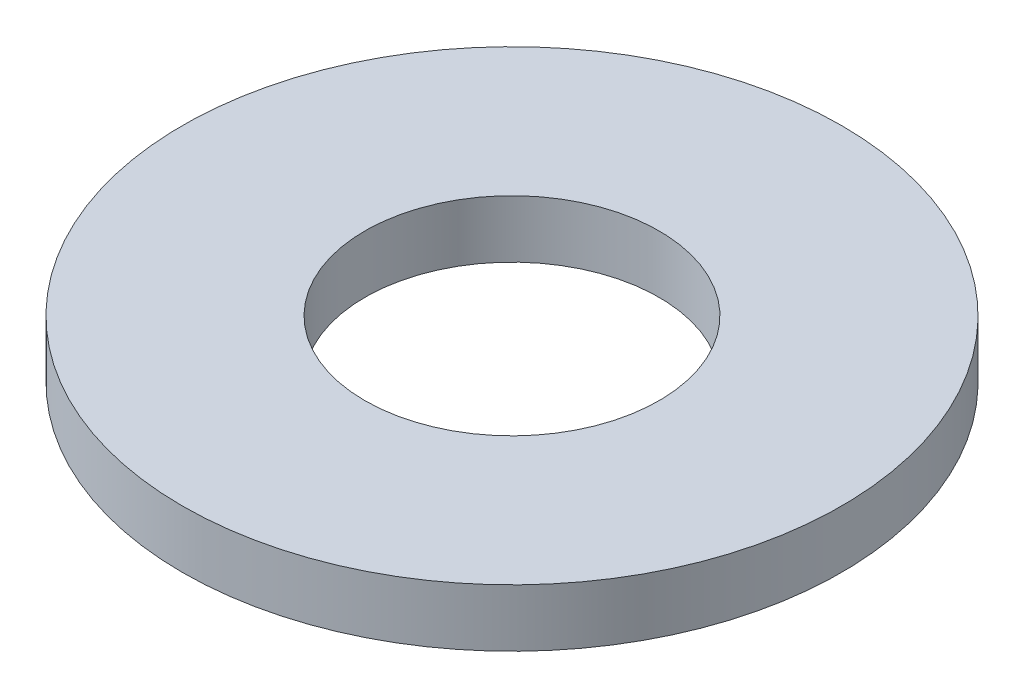
from build123d import *

# Parameters (mm, degrees)
MAIN_SKETCH_R        = 12.425
MAIN_SKETCH_R_2      = 5.545
O_RING_EXTRUDE_DEPTH = 1.085


with BuildPart() as part:
    # Main Sketch → O-Ring Extrude (new, symmetric)
    with BuildSketch(Plane(origin=(0, 0, 0), x_dir=(1, 0, 0), z_dir=(0, 1, 0))):
        with Locations(Location((0, 0, 0), (0, 0, 270))):
            Circle(MAIN_SKETCH_R)
        with Locations(Location((0, 0, 0), (0, 0, 270))):
            Circle(MAIN_SKETCH_R_2, mode=Mode.SUBTRACT)
    extrude(amount=O_RING_EXTRUDE_DEPTH, both=True)


solid = part.part
